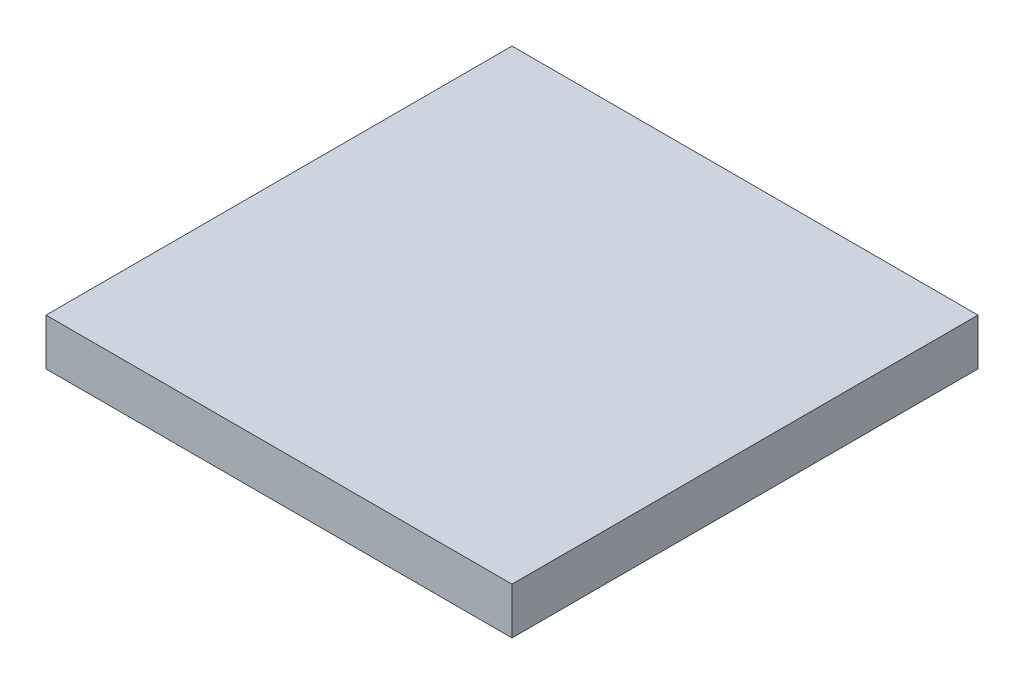
from build123d import *

# Parameters (mm, degrees)
SKETCH_1_W           = 10
SKETCH_1_H           = 1
AUTOFILLETTHIN_DEPTH = 10


with BuildPart() as part:
    # 草图1 → AutoFilletThin (new body)
    with BuildSketch(Plane.XY):
        with Locations((0, -0.5)):
            Rectangle(SKETCH_1_W, SKETCH_1_H)
    extrude(amount=AUTOFILLETTHIN_DEPTH)


solid = part.part
